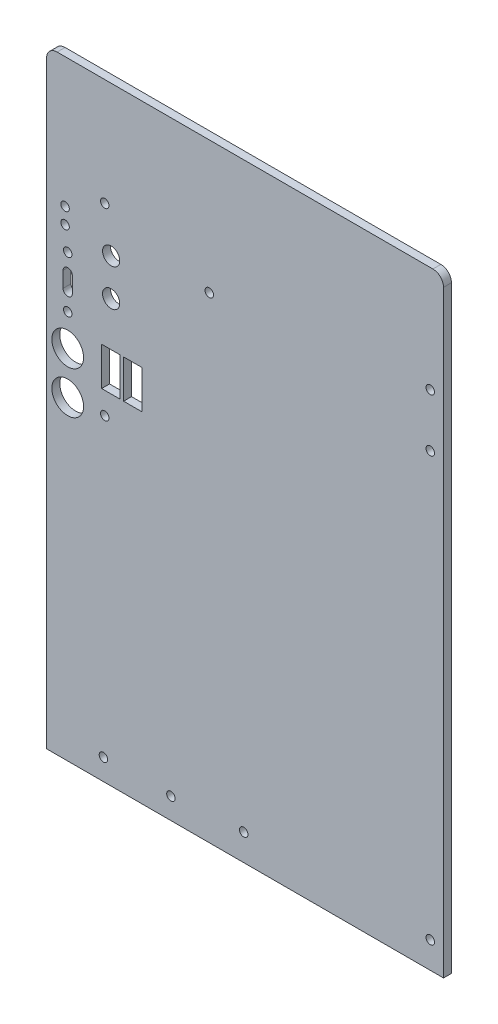
from build123d import *

# Parameters (mm, degrees)
SKETCH_1_W          = 150
SKETCH_1_H          = 230
EXTRUDE_1_DEPTH     = 3
CUT_EXTRUDE_1_REACH = 276.607
SKETCH_2_R          = 1.6
FILLET_1_R          = 4
CUT_EXTRUDE_2_REACH = 276.607
SKETCH_3_R          = 6
SKETCH_3_R_2        = 1.6
CUT_EXTRUDE_3_REACH = 276.607
SKETCH_4_R          = 1.6
SKETCH_4_R_2        = 3.25
SKETCH_4_W          = 7
SKETCH_4_H          = 14.5


with BuildPart() as part:
    # 草图1 → 凸台-拉伸1 (new body)
    with BuildSketch(Plane.XY):
        with Locations((75, 115)):
            Rectangle(SKETCH_1_W, SKETCH_1_H)
    extrude(amount=EXTRUDE_1_DEPTH)

    # 草图2 → 切除-拉伸1 (cut, up to next)
    with BuildSketch(Plane.XY.offset(3), mode=Mode.PRIVATE) as cut_extrude_1_sk1:
        with Locations((21.5, 8)):
            Circle(SKETCH_2_R)
    cut_extrude_1_tool1 = extrude(cut_extrude_1_sk1.sketch, amount=-CUT_EXTRUDE_1_REACH, mode=Mode.PRIVATE) & part.part
    # 草图2 → 切除-拉伸1 (cut, up to next)
    with BuildSketch(Plane.XY.offset(3), mode=Mode.PRIVATE) as cut_extrude_1_sk2:
        with Locations((47, 8)):
            Circle(SKETCH_2_R)
    cut_extrude_1_tool2 = extrude(cut_extrude_1_sk2.sketch, amount=-CUT_EXTRUDE_1_REACH, mode=Mode.PRIVATE) & part.part
    # 草图2 → 切除-拉伸1 (cut, up to next)
    with BuildSketch(Plane.XY.offset(3), mode=Mode.PRIVATE) as cut_extrude_1_sk3:
        with Locations((74.5, 10)):
            Circle(SKETCH_2_R)
    cut_extrude_1_tool3 = extrude(cut_extrude_1_sk3.sketch, amount=-CUT_EXTRUDE_1_REACH, mode=Mode.PRIVATE) & part.part
    # 草图2 → 切除-拉伸1 (cut, up to next)
    with BuildSketch(Plane.XY.offset(3), mode=Mode.PRIVATE) as cut_extrude_1_sk4:
        with Locations((145, 10)):
            Circle(SKETCH_2_R)
    cut_extrude_1_tool4 = extrude(cut_extrude_1_sk4.sketch, amount=-CUT_EXTRUDE_1_REACH, mode=Mode.PRIVATE) & part.part
    # 草图2 → 切除-拉伸1 (cut, up to next)
    with BuildSketch(Plane.XY.offset(3), mode=Mode.PRIVATE) as cut_extrude_1_sk5:
        with Locations((61.5, 180)):
            Circle(SKETCH_2_R)
    cut_extrude_1_tool5 = extrude(cut_extrude_1_sk5.sketch, amount=-CUT_EXTRUDE_1_REACH, mode=Mode.PRIVATE) & part.part
    # 草图2 → 切除-拉伸1 (cut, up to next)
    with BuildSketch(Plane.XY.offset(3), mode=Mode.PRIVATE) as cut_extrude_1_sk6:
        with Locations((145, 190)):
            Circle(SKETCH_2_R)
    cut_extrude_1_tool6 = extrude(cut_extrude_1_sk6.sketch, amount=-CUT_EXTRUDE_1_REACH, mode=Mode.PRIVATE) & part.part
    # 草图2 → 切除-拉伸1 (cut, up to next)
    with BuildSketch(Plane.XY.offset(3), mode=Mode.PRIVATE) as cut_extrude_1_sk7:
        with Locations((145, 170)):
            Circle(SKETCH_2_R)
    cut_extrude_1_tool7 = extrude(cut_extrude_1_sk7.sketch, amount=-CUT_EXTRUDE_1_REACH, mode=Mode.PRIVATE) & part.part
    # 草图2 → 切除-拉伸1 (cut, up to next)
    with BuildSketch(Plane.XY.offset(3), mode=Mode.PRIVATE) as cut_extrude_1_sk8:
        with Locations((7, 181)):
            Circle(SKETCH_2_R)
    cut_extrude_1_tool8 = extrude(cut_extrude_1_sk8.sketch, amount=-CUT_EXTRUDE_1_REACH, mode=Mode.PRIVATE) & part.part
    # 草图2 → 切除-拉伸1 (cut, up to next)
    with BuildSketch(Plane.XY.offset(3), mode=Mode.PRIVATE) as cut_extrude_1_sk9:
        with Locations((7, 175)):
            Circle(SKETCH_2_R)
    cut_extrude_1_tool9 = extrude(cut_extrude_1_sk9.sketch, amount=-CUT_EXTRUDE_1_REACH, mode=Mode.PRIVATE) & part.part
    add(cut_extrude_1_tool1.solids().sort_by_distance((21.5, 8, 3))[0], mode=Mode.SUBTRACT)
    add(cut_extrude_1_tool2.solids().sort_by_distance((47, 8, 3))[0], mode=Mode.SUBTRACT)
    add(cut_extrude_1_tool3.solids().sort_by_distance((74.5, 10, 3))[0], mode=Mode.SUBTRACT)
    add(cut_extrude_1_tool4.solids().sort_by_distance((145, 10, 3))[0], mode=Mode.SUBTRACT)
    add(cut_extrude_1_tool5.solids().sort_by_distance((61.5, 180, 3))[0], mode=Mode.SUBTRACT)
    add(cut_extrude_1_tool6.solids().sort_by_distance((145, 190, 3))[0], mode=Mode.SUBTRACT)
    add(cut_extrude_1_tool7.solids().sort_by_distance((145, 170, 3))[0], mode=Mode.SUBTRACT)
    add(cut_extrude_1_tool8.solids().sort_by_distance((7, 181, 3))[0], mode=Mode.SUBTRACT)
    add(cut_extrude_1_tool9.solids().sort_by_distance((7, 175, 3))[0], mode=Mode.SUBTRACT)

    # 圆角1
    fillet_1_edges = [part.edges().sort_by_distance(p)[0] for p in [
        (0, 230, 1.5),
        (150, 230, 1.5),
    ]]
    fillet(fillet_1_edges, radius=FILLET_1_R)

    # 草图3 → 切除-拉伸2 (cut, up to next)
    with BuildSketch(Plane.XY.offset(3), mode=Mode.PRIVATE) as cut_extrude_2_sk1:
        with Locations((8, 135)):
            Circle(SKETCH_3_R)
    cut_extrude_2_tool1 = extrude(cut_extrude_2_sk1.sketch, amount=-CUT_EXTRUDE_2_REACH, mode=Mode.PRIVATE) & part.part
    # 草图3 → 切除-拉伸2 (cut, up to next)
    with BuildSketch(Plane.XY.offset(3), mode=Mode.PRIVATE) as cut_extrude_2_sk2:
        with Locations((8, 119)):
            Circle(SKETCH_3_R)
    cut_extrude_2_tool2 = extrude(cut_extrude_2_sk2.sketch, amount=-CUT_EXTRUDE_2_REACH, mode=Mode.PRIVATE) & part.part
    # 草图3 → 切除-拉伸2 (cut, up to next)
    with BuildSketch(Plane.XY.offset(3), mode=Mode.PRIVATE) as cut_extrude_2_sk3:
        with Locations((8, 166.5)):
            Circle(SKETCH_3_R_2)
    cut_extrude_2_tool3 = extrude(cut_extrude_2_sk3.sketch, amount=-CUT_EXTRUDE_2_REACH, mode=Mode.PRIVATE) & part.part
    # 草图3 → 切除-拉伸2 (cut, up to next)
    with BuildSketch(Plane.XY.offset(3), mode=Mode.PRIVATE) as cut_extrude_2_sk4:
        with Locations((8, 147)):
            Circle(SKETCH_3_R_2)
    cut_extrude_2_tool4 = extrude(cut_extrude_2_sk4.sketch, amount=-CUT_EXTRUDE_2_REACH, mode=Mode.PRIVATE) & part.part
    # 草图3 → 切除-拉伸2 (cut, up to next)
    with BuildSketch(Plane.XY.offset(3), mode=Mode.PRIVATE) as cut_extrude_2_sk5:
        with BuildLine():
            Line((6.25, 153.8), (6.25, 159.7))
            ThreePointArc((6.25, 159.7), (8, 161.45), (9.75, 159.7))
            Line((9.75, 159.7), (9.75, 153.8))
            ThreePointArc((9.75, 153.8), (8, 152.05), (6.25, 153.8))
        make_face()
    cut_extrude_2_tool5 = extrude(cut_extrude_2_sk5.sketch, amount=-CUT_EXTRUDE_2_REACH, mode=Mode.PRIVATE) & part.part
    add(cut_extrude_2_tool1.solids().sort_by_distance((8, 135, 3))[0], mode=Mode.SUBTRACT)
    add(cut_extrude_2_tool2.solids().sort_by_distance((8, 119, 3))[0], mode=Mode.SUBTRACT)
    add(cut_extrude_2_tool3.solids().sort_by_distance((8, 166.5, 3))[0], mode=Mode.SUBTRACT)
    add(cut_extrude_2_tool4.solids().sort_by_distance((8, 147, 3))[0], mode=Mode.SUBTRACT)
    add(cut_extrude_2_tool5.solids().sort_by_distance((8, 156.75, 3))[0], mode=Mode.SUBTRACT)

    # 草图4 → 切除-拉伸3 (cut, up to next)
    with BuildSketch(Plane.XY.offset(3), mode=Mode.PRIVATE) as cut_extrude_3_sk1:
        with Locations((22, 120)):
            Circle(SKETCH_4_R)
    cut_extrude_3_tool1 = extrude(cut_extrude_3_sk1.sketch, amount=-CUT_EXTRUDE_3_REACH, mode=Mode.PRIVATE) & part.part
    # 草图4 → 切除-拉伸3 (cut, up to next)
    with BuildSketch(Plane.XY.offset(3), mode=Mode.PRIVATE) as cut_extrude_3_sk2:
        with Locations((22, 189.5)):
            Circle(SKETCH_4_R)
    cut_extrude_3_tool2 = extrude(cut_extrude_3_sk2.sketch, amount=-CUT_EXTRUDE_3_REACH, mode=Mode.PRIVATE) & part.part
    # 草图4 → 切除-拉伸3 (cut, up to next)
    with BuildSketch(Plane.XY.offset(3), mode=Mode.PRIVATE) as cut_extrude_3_sk3:
        with Locations((24.415, 173.5)):
            Circle(SKETCH_4_R_2)
    cut_extrude_3_tool3 = extrude(cut_extrude_3_sk3.sketch, amount=-CUT_EXTRUDE_3_REACH, mode=Mode.PRIVATE) & part.part
    # 草图4 → 切除-拉伸3 (cut, up to next)
    with BuildSketch(Plane.XY.offset(3), mode=Mode.PRIVATE) as cut_extrude_3_sk4:
        with Locations((24.415, 159.5)):
            Circle(SKETCH_4_R_2)
    cut_extrude_3_tool4 = extrude(cut_extrude_3_sk4.sketch, amount=-CUT_EXTRUDE_3_REACH, mode=Mode.PRIVATE) & part.part
    # 草图4 → 切除-拉伸3 (cut, up to next)
    with BuildSketch(Plane.XY.offset(3), mode=Mode.PRIVATE) as cut_extrude_3_sk5:
        with Locations((24.32, 135.55)):
            Rectangle(SKETCH_4_W, SKETCH_4_H)
    cut_extrude_3_tool5 = extrude(cut_extrude_3_sk5.sketch, amount=-CUT_EXTRUDE_3_REACH, mode=Mode.PRIVATE) & part.part
    # 草图4 → 切除-拉伸3 (cut, up to next)
    with BuildSketch(Plane.XY.offset(3), mode=Mode.PRIVATE) as cut_extrude_3_sk6:
        with Locations((32.62, 135.55)):
            Rectangle(SKETCH_4_W, SKETCH_4_H)
    cut_extrude_3_tool6 = extrude(cut_extrude_3_sk6.sketch, amount=-CUT_EXTRUDE_3_REACH, mode=Mode.PRIVATE) & part.part
    add(cut_extrude_3_tool1.solids().sort_by_distance((22, 120, 3))[0], mode=Mode.SUBTRACT)
    add(cut_extrude_3_tool2.solids().sort_by_distance((22, 189.5, 3))[0], mode=Mode.SUBTRACT)
    add(cut_extrude_3_tool3.solids().sort_by_distance((24.415, 173.5, 3))[0], mode=Mode.SUBTRACT)
    add(cut_extrude_3_tool4.solids().sort_by_distance((24.415, 159.5, 3))[0], mode=Mode.SUBTRACT)
    add(cut_extrude_3_tool5.solids().sort_by_distance((24.32, 135.55, 3))[0], mode=Mode.SUBTRACT)
    add(cut_extrude_3_tool6.solids().sort_by_distance((32.62, 135.55, 3))[0], mode=Mode.SUBTRACT)


solid = part.part
